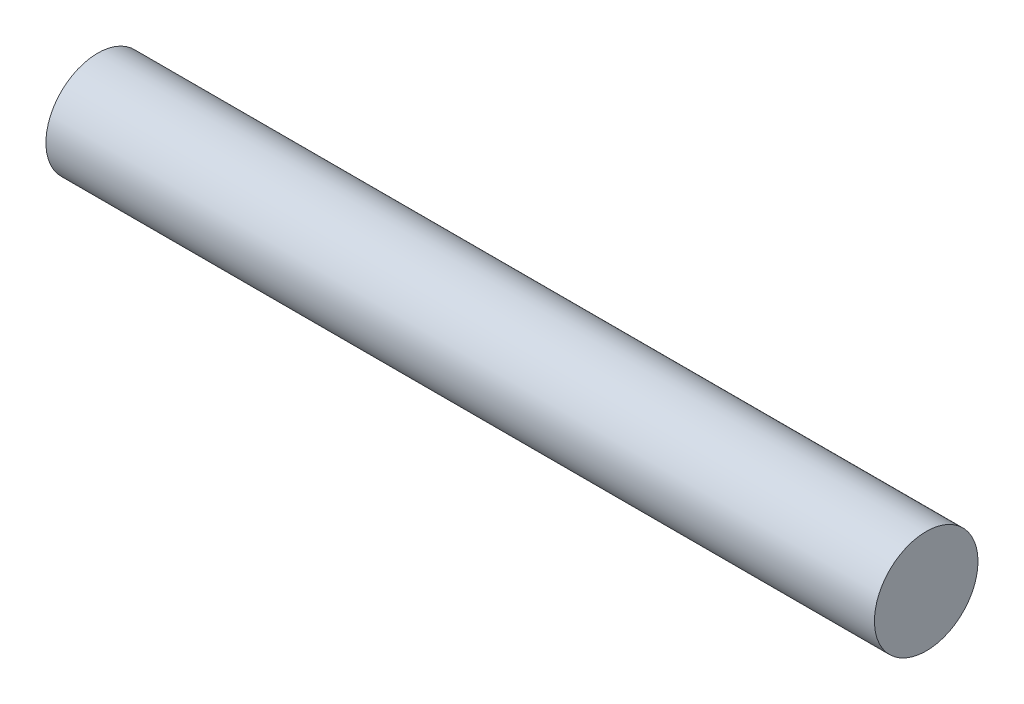
from build123d import *

# Parameters (mm, degrees)
ESQUISSE1_R        = 1
BOSS_EXTRU_1_DEPTH = 16


with BuildPart() as part:
    # Esquisse1 → Boss.-Extru.1 (new body)
    with BuildSketch(Plane(origin=(0, 0, 0), x_dir=(0, 0, -1), z_dir=(1, 0, 0))):
        Circle(ESQUISSE1_R)
    extrude(amount=BOSS_EXTRU_1_DEPTH)


solid = part.part
